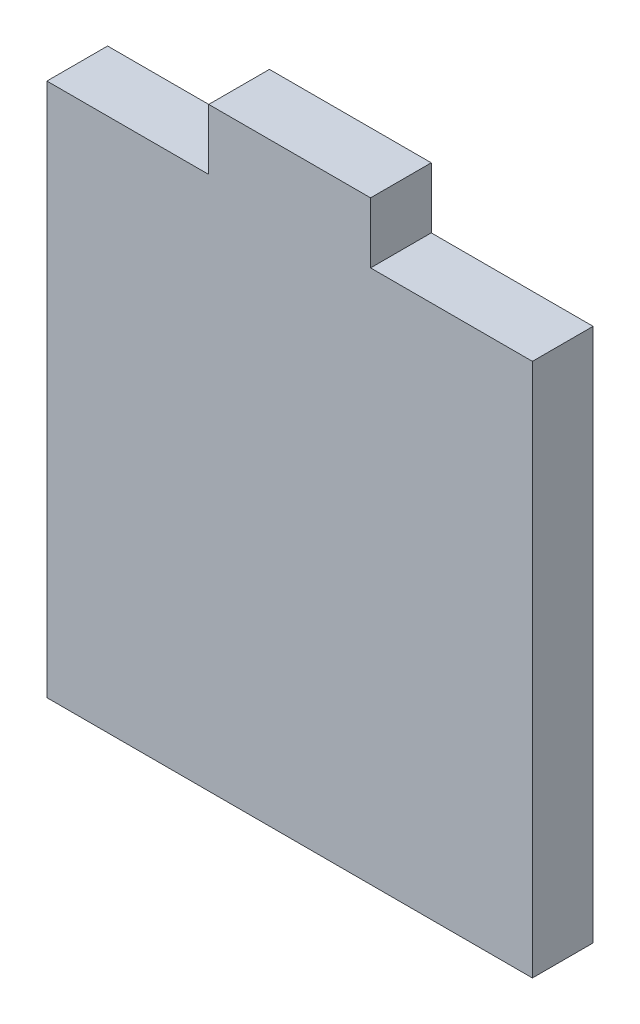
from build123d import *

# Parameters (mm, degrees)
BOSS_EXTRUDE1_DEPTH = 4.7625


with BuildPart() as part:
    # Sketch1 → Boss-Extrude1 (new body)
    with BuildSketch(Plane.XY):
        Polygon((25.4, 41.91), (38.1, 41.91), (38.1, 0), (0, 0), (0, 41.91), (12.7, 41.91), (12.7, 46.6725), (25.4, 46.6725), align=None)
    extrude(amount=BOSS_EXTRUDE1_DEPTH)


solid = part.part
